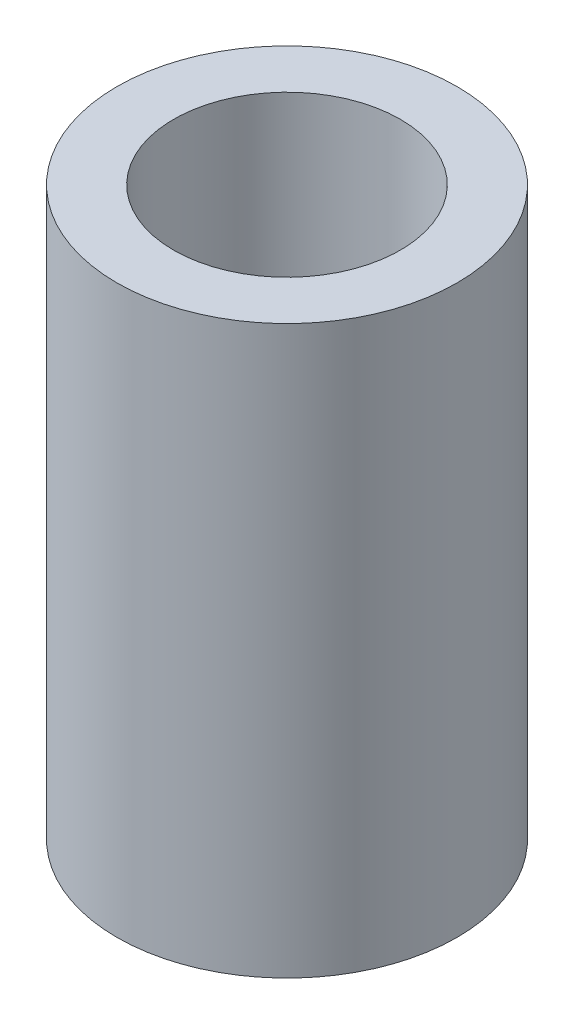
from build123d import *

# Parameters (mm, degrees)
ESQUISSE1_R      = 3
ESQUISSE1_R_2    = 2
EXTRUSION1_DEPTH = 5


with BuildPart() as part:
    # Esquisse1 → Extrusion1 (new, symmetric)
    with BuildSketch(Plane(origin=(0, 0, 0), x_dir=(1, 0, 0), z_dir=(0, 1, 0))):
        with Locations(Location((0, 0, 0), (0, 0, 270))):
            Circle(ESQUISSE1_R)
        with Locations(Location((0, 0, 0), (0, 0, 270))):
            Circle(ESQUISSE1_R_2, mode=Mode.SUBTRACT)
    extrude(amount=EXTRUSION1_DEPTH, both=True)


solid = part.part
